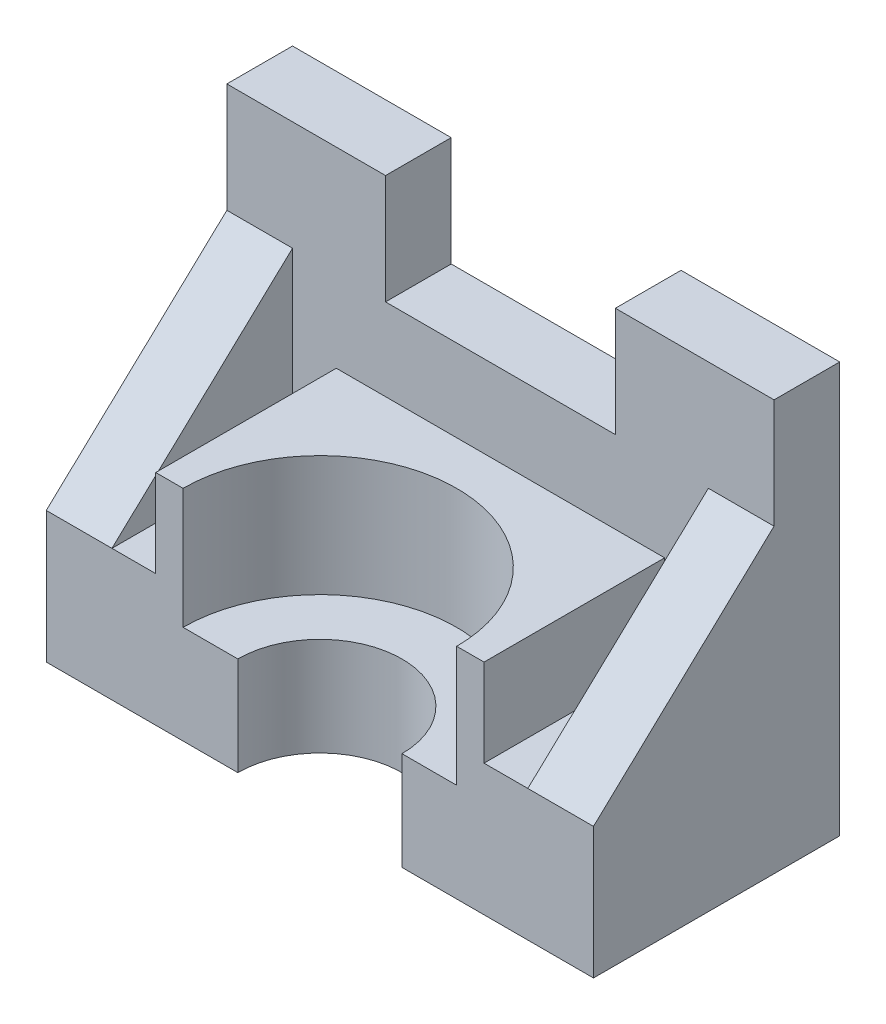
from build123d import *

# Parameters (mm, degrees)
BOSS_EXTRUDE3_DEPTH   = 18
SKETCH1_7_W           = 8
SKETCH1_7_H           = 33
BOSS_EXTRUDE4_DEPTH   = 24
BOSS_EXTRUDE4_2_DEPTH = 24
SKETCH1_8_W           = 12
SKETCH1_8_H           = 33
BOSS_EXTRUDE5_DEPTH   = 55
CUT_EXTRUDE1_DEPTH    = 1000
SKETCH1_9_W           = 29
SKETCH1_9_H           = 12
BOSS_EXTRUDE6_DEPTH   = 75
SKETCH1_10_W          = 42
SKETCH1_10_H          = 12
BOSS_EXTRUDE7_DEPTH   = 55
BOSS_EXTRUDE8_DEPTH   = 40


with BuildPart() as part:
    # Sketch1 → Boss-Extrude3 (new body)
    with BuildSketch(Plane(origin=(0, 0, 0), x_dir=(1, 0, 0), z_dir=(0, 1, 0))):
        with BuildLine():
            ThreePointArc((14.170014239, -17.420303066), (-10.829985761, 7.579696934), (-35.829985761, -17.420303066))
            Line((-35.829985761, -17.420303066), (-25.829985761, -17.420303066))
            ThreePointArc((-25.829985761, -17.420303066), (-10.829985761, -2.420303066), (4.170014239, -17.420303066))
            Line((4.170014239, -17.420303066), (14.170014239, -17.420303066))
        make_face()
    extrude(amount=BOSS_EXTRUDE3_DEPTH)



with BuildPart() as body_2:
    # Sketch1<7> → Boss-Extrude4 (new body)
    with BuildSketch(Plane(origin=(0, 0, 0), x_dir=(1, 0, 0), z_dir=(0, 1, 0))):
        with Locations((-44.829985761, -0.920303066)):
            Rectangle(SKETCH1_7_W, SKETCH1_7_H)
    extrude(amount=BOSS_EXTRUDE4_DEPTH)



with BuildPart() as body_3:
    # Sketch1<7> → Boss-Extrude4 2 (new body)
    with BuildSketch(Plane(origin=(0, 0, 0), x_dir=(1, 0, 0), z_dir=(0, 1, 0))):
        with Locations((23.170014239, -0.920303066)):
            Rectangle(SKETCH1_7_W, SKETCH1_7_H)
    extrude(amount=BOSS_EXTRUDE4_2_DEPTH)


with BuildPart() as body_2_1:
    add(body_2.part)

    add(body_3.part)  # Boss-Extrude5 merges body 3
    # Sketch1<8> → Boss-Extrude5 (add)
    with BuildSketch(Plane(origin=(0, 0, 0), x_dir=(1, 0, 0), z_dir=(0, 1, 0))):
        with Locations((-54.829985761, -0.920303066)):
            Rectangle(SKETCH1_8_W, SKETCH1_8_H)
        with Locations((33.170014239, -0.920303066)):
            Rectangle(SKETCH1_8_W, SKETCH1_8_H)
    extrude(amount=BOSS_EXTRUDE5_DEPTH)

    # Sketch2 → Cut-Extrude1 (cut)
    with BuildSketch(Plane.ZY.offset(60.829985761)):
        Polygon((17.420303066, 55), (17.420303066, 24), (-15.579696934, 55), align=None)
    extrude(amount=-CUT_EXTRUDE1_DEPTH, mode=Mode.SUBTRACT)

    # Sketch1<9> → Boss-Extrude6 (add)
    with BuildSketch(Plane(origin=(0, 0, 0), x_dir=(1, 0, 0), z_dir=(0, 1, 0))):
        with Locations((-46.329985761, 21.579696934)):
            Rectangle(SKETCH1_9_W, SKETCH1_9_H)
        with Locations((24.670014239, 21.579696934)):
            Rectangle(SKETCH1_9_W, SKETCH1_9_H)
    extrude(amount=BOSS_EXTRUDE6_DEPTH)

    # Sketch1<10> → Boss-Extrude7 (add)
    with BuildSketch(Plane(origin=(0, 0, 0), x_dir=(1, 0, 0), z_dir=(0, 1, 0))):
        with Locations((-10.829985761, 21.579696934)):
            Rectangle(SKETCH1_10_W, SKETCH1_10_H)
    extrude(amount=BOSS_EXTRUDE7_DEPTH)


with BuildPart() as part_1:
    add(part.part)

    add(body_2_1.part)  # Boss-Extrude8 merges body 2
    # Sketch1<11> → Boss-Extrude8 (add)
    with BuildSketch(Plane(origin=(0, 0, 0), x_dir=(1, 0, 0), z_dir=(0, 1, 0))):
        with BuildLine():
            Line((-40.829985761, 15.579696934), (-40.829985761, -17.420303066))
            Line((-40.829985761, -17.420303066), (-35.829985761, -17.420303066))
            ThreePointArc((-35.829985761, -17.420303066), (-10.829985761, 7.579696934), (14.170014239, -17.420303066))
            Line((14.170014239, -17.420303066), (19.170014239, -17.420303066))
            Line((19.170014239, -17.420303066), (19.170014239, 15.579696934))
            Line((19.170014239, 15.579696934), (10.170014239, 15.579696934))
            Line((10.170014239, 15.579696934), (-31.829985761, 15.579696934))
            Line((-31.829985761, 15.579696934), (-40.829985761, 15.579696934))
        make_face()
    extrude(amount=BOSS_EXTRUDE8_DEPTH)


solid = part_1.part
